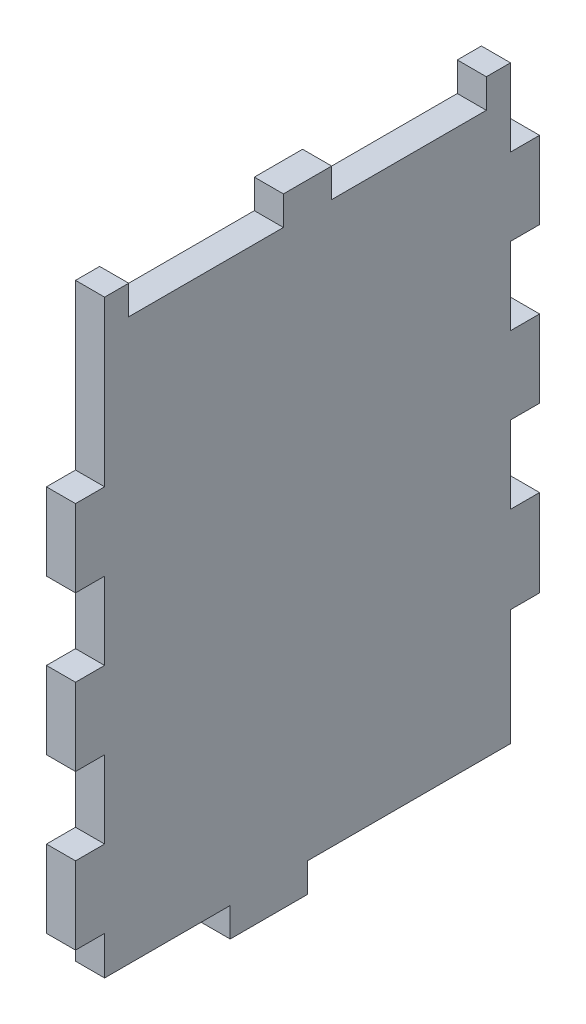
from build123d import *

# Parameters (mm, degrees)
SKETCH2_W           = 76.2
SKETCH2_H           = 101.6
BOSS_EXTRUDE1_DEPTH = 4.7752
SKETCH3_W           = 25.4
SKETCH3_H           = 4.7752
SKETCH3_W_2         = 38.1
CUT_EXTRUDE1_DEPTH  = 6.35
SKETCH4_W           = 4.7752
SKETCH4_H           = 26.9748
SKETCH4_H_2         = 12.7
SKETCH4_H_3         = 6.35
SKETCH4_H_4         = 19.05
CUT_EXTRUDE2_DEPTH  = 6.35
SKETCH6_W           = 12.7
SKETCH6_H           = 4.775408317
CUT_EXTRUDE4_DEPTH  = 4.7752


with BuildPart() as part:
    # Sketch2 → Boss-Extrude1 (new body)
    with BuildSketch(Plane(origin=(0, 0, 0), x_dir=(0, 0, -1), z_dir=(1, 0, 0))):
        with Locations((38.1, 50.8)):
            Rectangle(SKETCH2_W, SKETCH2_H)
    extrude(amount=BOSS_EXTRUDE1_DEPTH)

    # Sketch3 → Cut-Extrude1 (cut)
    with BuildSketch(Plane(origin=(4.7752, 0, 0), x_dir=(0, 0, -1), z_dir=(1, 0, 0))):
        with Locations((12.7, 2.3876)):
            Rectangle(SKETCH3_W, SKETCH3_H)
        with Locations((57.15, 2.3876)):
            Rectangle(SKETCH3_W_2, SKETCH3_H)
    extrude(amount=-CUT_EXTRUDE1_DEPTH, mode=Mode.SUBTRACT)

    # Sketch4 → Cut-Extrude2 (cut)
    with BuildSketch(Plane(origin=(4.7752, 0, 0), x_dir=(0, 0, -1), z_dir=(1, 0, 0))):
        with Locations((2.3876, 88.1126)):
            Rectangle(SKETCH4_W, SKETCH4_H)
        with Locations((73.8124, 95.25)):
            Rectangle(SKETCH4_W, SKETCH4_H_2)
        with Locations((73.8124, 69.85)):
            Rectangle(SKETCH4_W, SKETCH4_H_2)
        with Locations((2.3876, 7.9502)):
            Rectangle(SKETCH4_W, SKETCH4_H_3)
        with Locations((73.8124, 14.3002)):
            Rectangle(SKETCH4_W, SKETCH4_H_4)
        with Locations((73.8124, 44.45)):
            Rectangle(SKETCH4_W, SKETCH4_H_2)
        with Locations((2.3876, 55.5752)):
            Rectangle(SKETCH4_W, SKETCH4_H_2)
        with Locations((2.3876, 30.1752)):
            Rectangle(SKETCH4_W, SKETCH4_H_2)
    extrude(amount=-CUT_EXTRUDE2_DEPTH, mode=Mode.SUBTRACT)

    # Sketch6 → Cut-Extrude4 (cut)
    with BuildSketch(Plane(origin=(4.7752, 0, 0), x_dir=(0, 0, -1), z_dir=(1, 0, 0))):
        with Locations((27.7876, 99.212295842)):
            Rectangle(SKETCH6_W, SKETCH6_H)
        with Locations((15.0876, 99.212295842)):
            Rectangle(SKETCH6_W, SKETCH6_H)
        with Locations((48.4124, 99.212295842)):
            Rectangle(SKETCH6_W, SKETCH6_H)
        with Locations((61.1124, 99.212295842)):
            Rectangle(SKETCH6_W, SKETCH6_H)
    extrude(amount=-CUT_EXTRUDE4_DEPTH, mode=Mode.SUBTRACT)


solid = part.part
